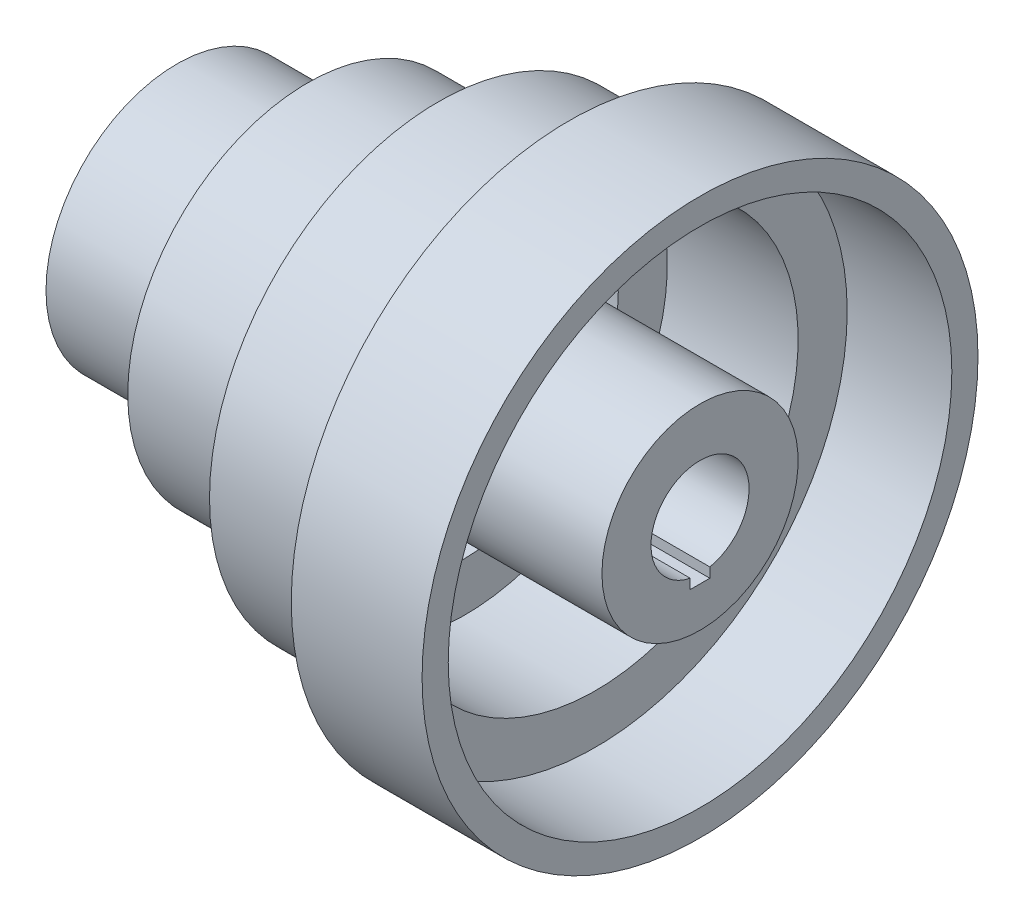
from build123d import *

# Parameters (mm, degrees)
CUT_EXTRUDE1_REACH = 202.125


with BuildPart() as part:
    # Sketch1 → Revolve1 (revolve)
    with BuildSketch(Plane(origin=(0, 0, 0), x_dir=(1, 0, 0), z_dir=(0, 1, 0)), mode=Mode.PRIVATE) as revolve1_sk:
        Polygon((0, 15), (0, 40), (40, 40), (40, 55), (80, 55), (80, 70), (120, 70), (120, 85), (160, 85), (160, 77), (128, 77), (128, 62), (88, 62), (88, 47), (48, 47), (48, 30), (160, 30), (160, 15), align=None)
    revolve(revolve1_sk.sketch.rotate(Axis((-116.687976722, 0, 0), (1, 0, 0)), 180), axis=Axis((-116.687976722, 0, 0), (1, 0, 0)))

    # Sketch2 → Cut-Extrude1 (cut, up to next)
    with BuildSketch(Plane.ZY, mode=Mode.PRIVATE) as cut_extrude1_sk1:
        with BuildLine():
            Line((-3, -14.696938457), (-3, -17.696938457))
            Line((-3, -17.696938457), (3, -17.696938457))
            Line((3, -17.696938457), (3, -14.696938457))
            ThreePointArc((3, -14.696938457), (0, -15), (-3, -14.696938457))
        make_face()
    cut_extrude1_tool1 = extrude(cut_extrude1_sk1.sketch, amount=-CUT_EXTRUDE1_REACH, mode=Mode.PRIVATE) & part.part
    add(cut_extrude1_tool1.solids().sort_by_distance((0, -16.29671, 0))[0], mode=Mode.SUBTRACT)


solid = part.part
